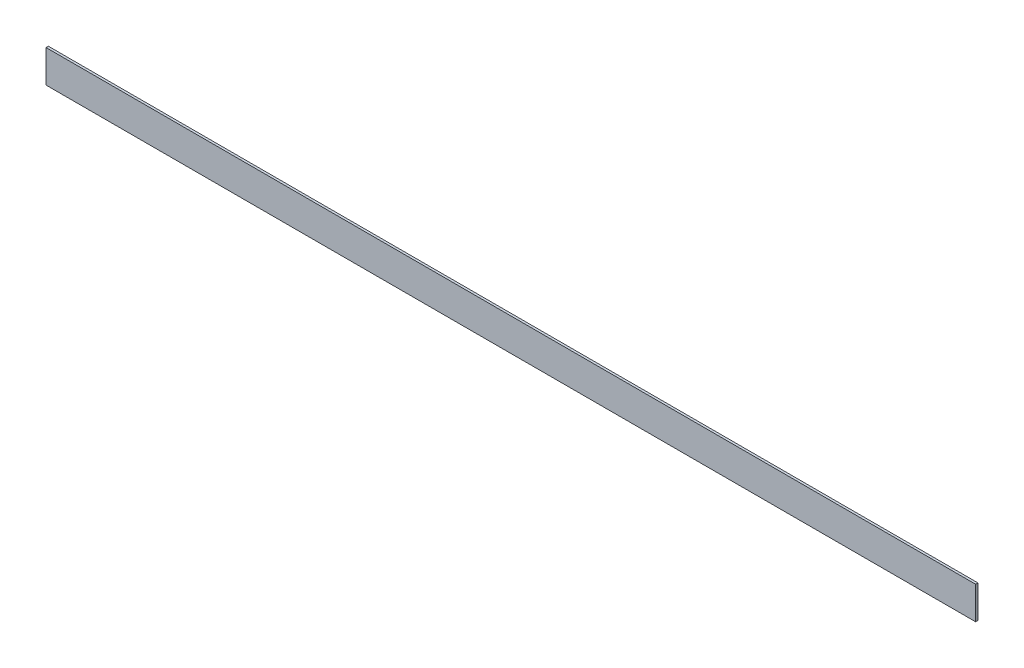
from build123d import *

# Parameters (mm, degrees)
SKETCH1_W           = 2000
SKETCH1_H           = 70
BOSS_EXTRUDE1_DEPTH = 5


with BuildPart() as part:
    # Sketch1 → Boss-Extrude1 (new body)
    with BuildSketch(Plane.XY):
        Rectangle(SKETCH1_W, SKETCH1_H)
    extrude(amount=BOSS_EXTRUDE1_DEPTH)


solid = part.part
